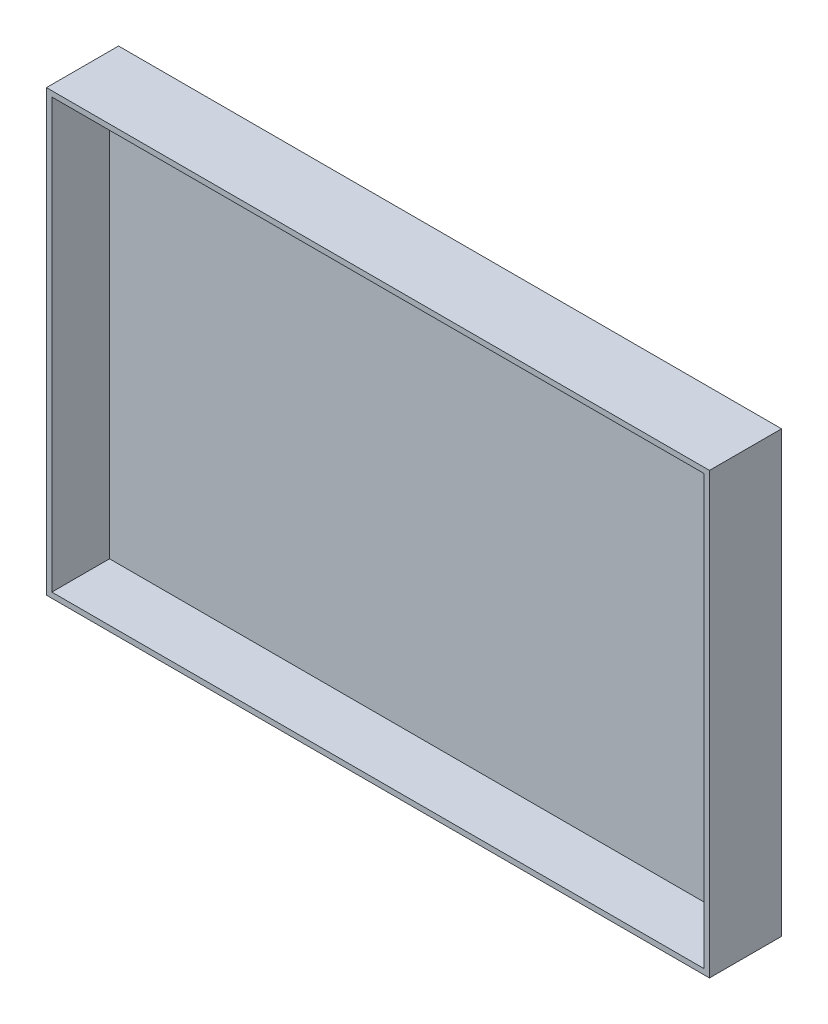
from build123d import *

# Parameters (mm, degrees)
SKETCH1_W           = 92
SKETCH1_H           = 61
SKETCH1_W_2         = 90.5
SKETCH1_H_2         = 59.5
BOSS_EXTRUDE1_DEPTH = 10
SKETCH2_W           = 92
SKETCH2_H           = 61
BOSS_EXTRUDE2_DEPTH = 2


with BuildPart() as part:
    # Sketch1 → Boss-Extrude1 (new body)
    with BuildSketch(Plane.XY):
        Rectangle(SKETCH1_W, SKETCH1_H)
        Rectangle(SKETCH1_W_2, SKETCH1_H_2, mode=Mode.SUBTRACT)
    extrude(amount=BOSS_EXTRUDE1_DEPTH)

    # Sketch2 → Boss-Extrude2 (add)
    with BuildSketch(Plane.XY):
        Rectangle(SKETCH2_W, SKETCH2_H)
    extrude(amount=BOSS_EXTRUDE2_DEPTH)


solid = part.part
